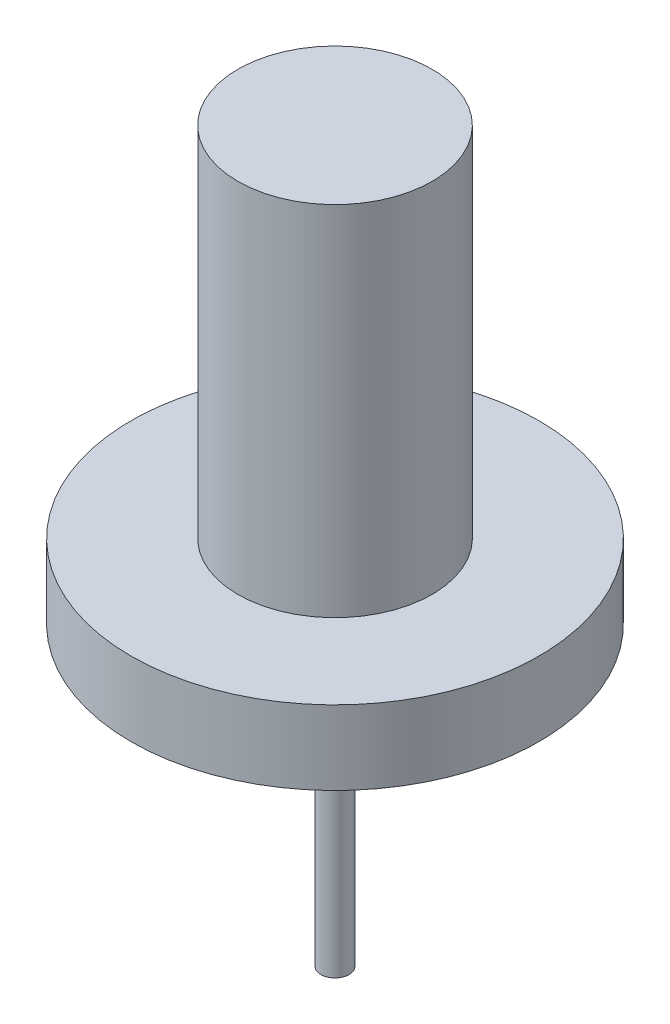
from build123d import *

# Parameters (mm, degrees)
SKETCH1_R      = 34.925
EXTRUDE1_DEPTH = 12.7
SKETCH2_R      = 16.637
EXTRUDE2_DEPTH = 61.2648
SKETCH3_R      = 2.40792343
EXTRUDE3_DEPTH = 50.8


with BuildPart() as part:
    # Sketch1 → Extrude1 (new body)
    with BuildSketch(Plane(origin=(0, 0, 0), x_dir=(1, 0, 0), z_dir=(0, 1, 0))):
        with Locations(Location((0, 0, 0), (0, 0, 270))):
            Circle(SKETCH1_R)
    extrude(amount=EXTRUDE1_DEPTH)

    # Sketch2 → Extrude2 (add)
    with BuildSketch(Plane(origin=(0, 12.7, 0), x_dir=(1, 0, 0), z_dir=(0, 1, 0))):
        with Locations(Location((0, 0, 0), (0, 0, 270))):
            Circle(SKETCH2_R)
    extrude(amount=EXTRUDE2_DEPTH)

    # Sketch3 → Extrude3 (add)
    with BuildSketch(Plane.XZ):
        with Locations(Location((0, 0, 0), (0, 0, 90))):
            Circle(SKETCH3_R)
    extrude(amount=EXTRUDE3_DEPTH)


solid = part.part
